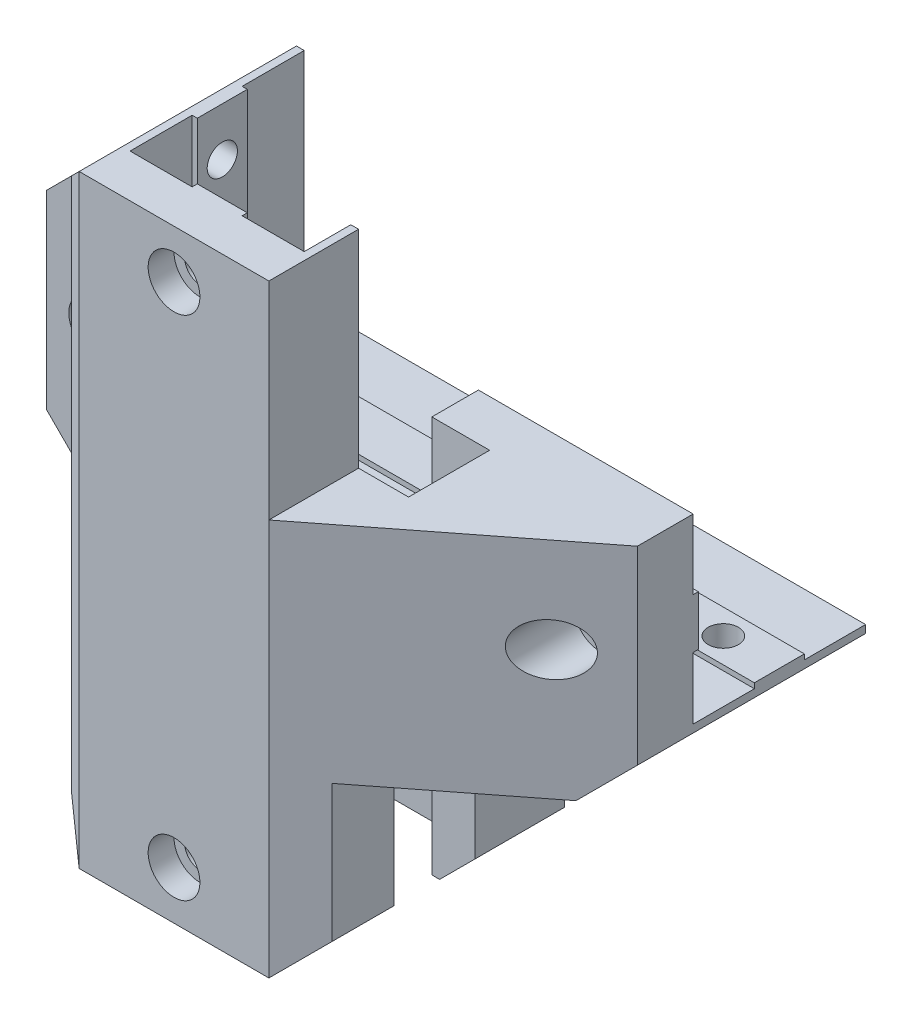
from build123d import *

# Parameters (mm, degrees)
EXTRUDE_1_DEPTH          = 22
CUT_EXTRUDE_2_DEPTH      = 82.358095651
SKETCH_3_W               = 24.9
SKETCH_3_H               = 5.8
EXTRUDE_2_DEPTH          = 0.6
CUT_EXTRUDE_3_DEPTH      = 57.272077989
EXTRUDE_3_DEPTH          = 20
CUT_EXTRUDE_4_DEPTH      = 57.272077989
CUT_EXTRUDE_4_DEPTH_BACK = 57.272077989
SKETCH_7_W               = 19.9
SKETCH_7_H               = 17
CUT_EXTRUDE_5_DEPTH      = 65.954905342
SKETCH_8_W               = 15
SKETCH_8_H               = 20
CUT_EXTRUDE_6_DEPTH      = 67.643957215
CUT_EXTRUDE_7_DEPTH      = 57.509351096
CUT_EXTRUDE_7_DEPTH_BACK = 57.509351096
SKETCH_9_R               = 1.75
SKETCH_10_R              = 1.75
CUT_EXTRUDE_8_DEPTH      = 63.543241308
SKETCH_11_W              = 0.9
SKETCH_11_H              = 24
CUT_EXTRUDE_9_DEPTH      = 10
EXTRUDE_4_DEPTH          = 70
SKETCH_13_W              = 4.1
SKETCH_13_H              = 24
CUT_EXTRUDE_10_DEPTH     = 67.682432179
SKETCH_14_R              = 1.75
CUT_EXTRUDE_11_DEPTH     = 66.197444438
SKETCH_15_W              = 5.8
SKETCH_15_H              = 0.6
EXTRUDE_5_DEPTH          = 70
SKETCH_16_R              = 1.75
CUT_EXTRUDE_12_DEPTH     = 63.05183098
EXTRUDE_START            = -26
EXTRUDE_6_DEPTH          = 26
SKETCH_18_R              = 1.75
CUT_EXTRUDE_13_DEPTH     = 58.511275079
SKETCH_20_R              = 3
CUT_EXTRUDE_17_DEPTH     = 3
SKETCH_21_R              = 3
CUT_EXTRUDE_18_DEPTH     = 20
SKETCH_22_R              = 3
CUT_EXTRUDE_19_DEPTH     = 3
SKETCH_23_R              = 3
CUT_EXTRUDE_20_DEPTH     = 3
CUT_EXTRUDE_START        = -3
SKETCH_24_R              = 3
CUT_EXTRUDE_21_DEPTH     = 3
SKETCH_25_R              = 3
CUT_EXTRUDE_22_DEPTH     = 3
SKETCH_26_W              = 6.7
SKETCH_26_H              = 9.4
CUT_EXTRUDE_23_DEPTH     = 83.281101889


with BuildPart() as part:
    # 草图1 → 凸台-拉伸1 (new body)
    with BuildSketch(Plane.XY):
        Polygon((-34.855445258, 14.044802973), (-10.855445258, 38.044802973), (11.144554742, 38.044802973), (35.144554742, 14.044802973), (35.144554742, -7.955197027), (11.144554742, -31.955197027), (-10.855445258, -31.955197027), (-34.855445258, -7.955197027), align=None)
    extrude(amount=EXTRUDE_1_DEPTH)

    # 草图2 → 切除-拉伸2 (cut, through all)
    with BuildSketch(Plane(origin=(0, 38.044802973, 0), x_dir=(1, 0, 0), z_dir=(0, 1, 0))):
        Polygon((10.244554742, 0), (-9.955445258, 0), (-9.955445258, -7.2), (-9.355445258, -7.2), (-9.355445258, -13), (-9.955445258, -13), (-9.955445258, -20.2), (-2.755445258, -20.2), (-2.755445258, -19.6), (3.044554742, -19.6), (3.044554742, -20.2), (10.244554742, -20.2), (10.244554742, -14.8), (16.944554742, -14.8), (16.944554742, -5.4), (10.244554742, -5.4), align=None)
    extrude(amount=-CUT_EXTRUDE_2_DEPTH, mode=Mode.SUBTRACT)

    # 草图3 → 凸台-拉伸2 (add)
    with BuildSketch(Plane(origin=(0, 0, 0), x_dir=(-1, 0, 0), z_dir=(0, 0, -1))):
        with Locations((22.405445258, 3.044802973)):
            Rectangle(SKETCH_3_W, SKETCH_3_H)
        with Locations((-22.694554742, 3.044802973)):
            Rectangle(SKETCH_3_W, SKETCH_3_H)
    extrude(amount=EXTRUDE_2_DEPTH)

    # 草图4 → 切除-拉伸3 (cut, through all)
    with BuildSketch(Plane(origin=(0, 0, 0), x_dir=(-1, 0, 0), z_dir=(0, 0, -1))):
        Polygon((-35.144554742, 14.044802973), (-11.144554742, 38.044802973), (-11.144554742, 14.044802973), align=None)
    extrude(amount=-CUT_EXTRUDE_3_DEPTH, mode=Mode.SUBTRACT)

    # 草图5 → 凸台-拉伸3 (add)
    with BuildSketch(Plane(origin=(0, 0, 0), x_dir=(-1, 0, 0), z_dir=(0, 0, -1))):
        Polygon((-11.144554742, -31.955197027), (10.855445258, -31.955197027), (34.855445258, -7.955197027), (34.855445258, -7.055197027), (-35.144554742, -7.055197027), (-35.144554742, -7.955197027), align=None)
    extrude(amount=EXTRUDE_3_DEPTH)

    # 草图6 → 切除-拉伸4 (cut, two sides: drawn at the far end of the back side and taken through both)
    with BuildSketch(Plane(origin=(0, 0, 0), x_dir=(-1, 0, 0), z_dir=(0, 0, -1)).offset(-CUT_EXTRUDE_4_DEPTH_BACK)):
        Polygon((14.955445258, 33.944802973), (30.855445258, 18.044802973), (14.955445258, 18.044802973), align=None)
        Polygon((14.955445258, -11.955197027), (30.855445258, -11.955197027), (14.955445258, -27.855197027), align=None)
        Polygon((-15.244554742, -11.955197027), (-31.144554742, -11.955197027), (-15.244554742, -27.855197027), align=None)
    extrude(amount=CUT_EXTRUDE_4_DEPTH + CUT_EXTRUDE_4_DEPTH_BACK, mode=Mode.SUBTRACT)

    # 草图7 → 切除-拉伸5 (cut, through all)
    with BuildSketch(Plane(origin=(0, 18.044802973, 0), x_dir=(1, 0, 0), z_dir=(0, 1, 0))):
        with Locations((-24.905445258, -13.5)):
            Rectangle(SKETCH_7_W, SKETCH_7_H)
        with Locations((25.194554742, -13.5)):
            Rectangle(SKETCH_7_W, SKETCH_7_H)
    extrude(amount=-CUT_EXTRUDE_5_DEPTH, mode=Mode.SUBTRACT)

    # 草图8 → 切除-拉伸6 (cut, through all)
    with BuildSketch(Plane.ZY.offset(14.955445258)):
        with Locations((-12.5, -21.955197027)):
            Rectangle(SKETCH_8_W, SKETCH_8_H)
    extrude(amount=-CUT_EXTRUDE_6_DEPTH, mode=Mode.SUBTRACT)

    # 草图9 → 切除-拉伸7 (cut, two sides: drawn at the far end of the back side and taken through both)
    with BuildSketch(Plane(origin=(0, 0, -0.6), x_dir=(-1, 0, 0), z_dir=(0, 0, -1)).offset(-CUT_EXTRUDE_7_DEPTH_BACK)):
        with Locations((-29.544554742, 3.044802973)):
            Circle(SKETCH_9_R)
        with Locations((29.255445258, 3.044802973)):
            Circle(SKETCH_9_R)
        with Locations((-0.144554742, 32.444802973)):
            Circle(SKETCH_9_R)
        with Locations((-0.144554742, -26.355197027)):
            Circle(SKETCH_9_R)
    extrude(amount=CUT_EXTRUDE_7_DEPTH + CUT_EXTRUDE_7_DEPTH_BACK, mode=Mode.SUBTRACT)

    # 草图10 → 切除-拉伸8 (cut, through all)
    with BuildSketch(Plane(origin=(-9.355445258, 0, 0), x_dir=(0, 0, -1), z_dir=(1, 0, 0))):
        with Locations((-10.1, 32.444802973)):
            Circle(SKETCH_10_R)
        with Locations((-10.1, -26.355197027)):
            Circle(SKETCH_10_R)
        with Locations((-10.1, 3.044802973)):
            Circle(SKETCH_10_R)
    extrude(amount=-CUT_EXTRUDE_8_DEPTH, mode=Mode.SUBTRACT)

    # 草图11 → 切除-拉伸9 (cut)
    with BuildSketch(Plane(origin=(0, 0, 0), x_dir=(-1, 0, 0), z_dir=(0, 0, -1))):
        with Locations((-10.694554742, 26.044802973)):
            Rectangle(SKETCH_11_W, SKETCH_11_H)
    extrude(amount=-CUT_EXTRUDE_9_DEPTH, mode=Mode.SUBTRACT)

    # 草图12 → 凸台-拉伸4 (add)
    with BuildSketch(Plane(origin=(0, 38.044802973, 0), x_dir=(1, 0, 0), z_dir=(0, 1, 0))):
        Polygon((-14.955445258, -22), (-10.855445258, -25.2), (11.144554742, -25.2), (15.244554742, -22), align=None)
    extrude(amount=-EXTRUDE_4_DEPTH)

    # 草图13 → 切除-拉伸10 (cut, through all)
    with BuildSketch(Plane(origin=(0, 0, 22), x_dir=(-1, 0, 0), z_dir=(0, 0, -1))):
        Polygon((10.855445258, 38.044802973), (14.955445258, 38.044802973), (14.955445258, 33.944802973), align=None)
        with Locations((-13.194554742, 26.044802973)):
            Rectangle(SKETCH_13_W, SKETCH_13_H)
        Polygon((14.955445258, -27.855197027), (14.955445258, -31.955197027), (10.855445258, -31.955197027), align=None)
        Polygon((-15.244554742, -31.955197027), (-11.144554742, -31.955197027), (-15.244554742, -27.855197027), align=None)
    extrude(amount=-CUT_EXTRUDE_10_DEPTH, mode=Mode.SUBTRACT)

    # 草图14 → 切除-拉伸11 (cut, through all)
    with BuildSketch(Plane(origin=(0, 0, 19.6), x_dir=(-1, 0, 0), z_dir=(0, 0, -1))):
        with Locations((-0.144554742, 32.444802973)):
            Circle(SKETCH_14_R)
        with Locations((-0.144554742, -26.355197027)):
            Circle(SKETCH_14_R)
    extrude(amount=-CUT_EXTRUDE_11_DEPTH, mode=Mode.SUBTRACT)

    # 草图15 → 凸台-拉伸5 (add)
    with BuildSketch(Plane.ZY.offset(34.855445258)):
        with Locations((-10, -6.755197027)):
            Rectangle(SKETCH_15_W, SKETCH_15_H)
    extrude(amount=-EXTRUDE_5_DEPTH)

    # 草图16 → 切除-拉伸12 (cut, through all)
    with BuildSketch(Plane(origin=(0, -6.455197027, 0), x_dir=(1, 0, 0), z_dir=(0, 1, 0))):
        with Locations(Location((-28.355445258, 10, 0), (0, 0, 180))):
            Circle(SKETCH_16_R)
        with Locations(Location((28.644554742, 10, 0), (0, 0, 180))):
            Circle(SKETCH_16_R)
        with Locations(Location((0.144554742, 10, 0), (0, 0, 180))):
            Circle(SKETCH_16_R)
    extrude(amount=-CUT_EXTRUDE_12_DEPTH, mode=Mode.SUBTRACT)

    # 草图17 → 凸台-拉伸6 (add)
    with BuildSketch(Plane(origin=(0, 14.044802973, 0), x_dir=(1, 0, 0), z_dir=(0, 1, 0)).offset(EXTRUDE_START)):
        Polygon((15.244554742, -5), (15.244554742, -22), (35.144554742, -6.468292683), (35.144554742, -5), align=None)
    extrude(amount=EXTRUDE_6_DEPTH)

    # 草图18 → 切除-拉伸13 (cut, through all)
    with BuildSketch(Plane(origin=(0, 0, 5), x_dir=(-1, 0, 0), z_dir=(0, 0, -1))):
        with Locations((-29.544554742, 3.044802973)):
            Circle(SKETCH_18_R)
        Polygon((-35.144554742, -11.955197027), (-35.144554742, -7.955197027), (-31.144554742, -11.955197027), align=None)
    extrude(amount=-CUT_EXTRUDE_13_DEPTH, mode=Mode.SUBTRACT)

    # 草图20 → 切除-拉伸17 (cut)
    with BuildSketch(Plane.XY.offset(25.2)):
        with Locations((0.144554742, 32.444802973)):
            Circle(SKETCH_20_R)
        with Locations((0.144554742, -26.355197027)):
            Circle(SKETCH_20_R)
    extrude(amount=-CUT_EXTRUDE_17_DEPTH, mode=Mode.SUBTRACT)

    # 草图21 → 切除-拉伸18 (cut)
    with BuildSketch(Plane.XY.offset(25.2)):
        with Locations((29.544554742, 3.044802973)):
            Circle(SKETCH_21_R)
    extrude(amount=-CUT_EXTRUDE_18_DEPTH, mode=Mode.SUBTRACT)

    # 草图22 → 切除-拉伸19 (cut)
    with BuildSketch(Plane.ZY.offset(14.955445258)):
        with Locations(Location((10.1, 32.444802973, 0), (0, 0, 270))):
            Circle(SKETCH_22_R)
        with Locations(Location((10.1, 3.044802973, 0), (0, 0, 270))):
            Circle(SKETCH_22_R)
        with Locations(Location((10.1, -26.355197027, 0), (0, 0, 270))):
            Circle(SKETCH_22_R)
    extrude(amount=-CUT_EXTRUDE_19_DEPTH, mode=Mode.SUBTRACT)

    # 草图23 → 切除-拉伸20 (cut)
    with BuildSketch(Plane.XZ.offset(11.955197027)):
        with Locations(Location((-28.355445258, -10, 0), (0, 0, 270))):
            Circle(SKETCH_23_R)
        with Locations(Location((0.144554742, -10, 0), (0, 0, 270))):
            Circle(SKETCH_23_R)
        with Locations(Location((28.644554742, -10, 0), (0, 0, 270))):
            Circle(SKETCH_23_R)
    extrude(amount=-CUT_EXTRUDE_20_DEPTH, mode=Mode.SUBTRACT)

    # 草图24 → 切除-拉伸21 (cut)
    with BuildSketch(Plane(origin=(0, 0, -5), x_dir=(-1, 0, 0), z_dir=(0, 0, -1)).offset(CUT_EXTRUDE_START)):
        with Locations(Location((-0.144554742, -26.355197027, 0), (0, 0, 180))):
            Circle(SKETCH_24_R)
    extrude(amount=CUT_EXTRUDE_21_DEPTH, mode=Mode.SUBTRACT)

    # 草图25 → 切除-拉伸22 (cut)
    with BuildSketch(Plane.XY.offset(5)):
        with Locations((-29.255445258, 3.044802973)):
            Circle(SKETCH_25_R)
    extrude(amount=-CUT_EXTRUDE_22_DEPTH, mode=Mode.SUBTRACT)

    # 草图26 → 切除-拉伸23 (cut, through all)
    with BuildSketch(Plane(origin=(0, 38.044802973, 0), x_dir=(1, 0, 0), z_dir=(0, 1, 0))):
        with Locations((13.594554742, -10.1)):
            Rectangle(SKETCH_26_W, SKETCH_26_H)
    extrude(amount=-CUT_EXTRUDE_23_DEPTH, mode=Mode.SUBTRACT)


solid = part.part
